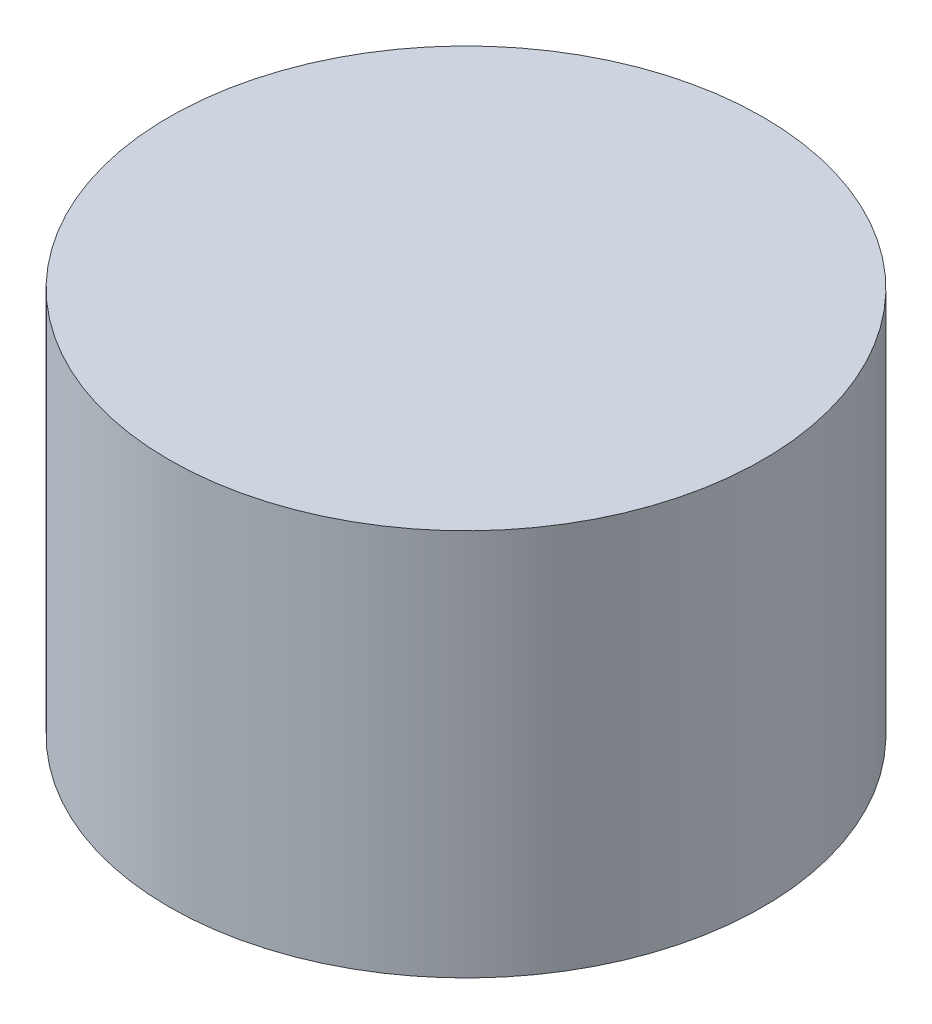
from build123d import *
from build123d.topology import SkipClean

# Parameters (mm, degrees)
SKIZZE3_R         = 11.5
CASTOR_BASE_DEPTH = 15


with BuildPart() as part:
    # Skizze3 → Castor Base (new body)
    with BuildSketch(Plane(origin=(0, 0, 0), x_dir=(1, 0, 0), z_dir=(0, 1, 0))):
        with Locations(Location((0, 0, 0), (0, 0, 270))):
            Circle(SKIZZE3_R)
    extrude(amount=-CASTOR_BASE_DEPTH)

    # Skizze4 → Castor Ball (revolve)
    with SkipClean():  # the faces are left unmerged after this step: merging them gives an invalid solid
        with BuildSketch(Plane.XY):
            with BuildLine():
                ThreePointArc((9.5, -11.5), (6.717514421, -4.782485579), (0, -2))
                Line((0, -2), (0, -21))
                ThreePointArc((0, -21), (6.717514421, -18.217514421), (9.5, -11.5))
            make_face()
            with BuildLine():
                Line((0, -21), (0, -2))
                ThreePointArc((0, -2), (-9.5, -11.5), (0, -21))
            make_face()
        revolve(axis=Axis((0, -2, 0), (0, -1, 0)))


solid = part.part
